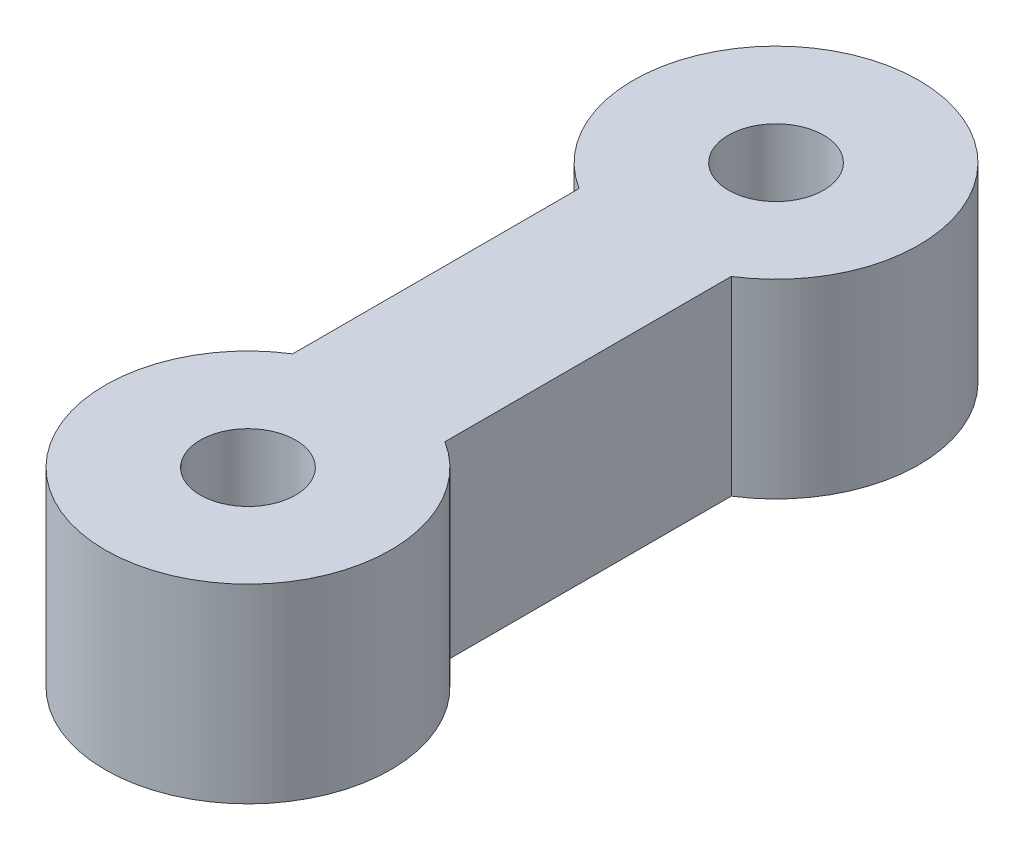
from build123d import *

# Parameters (mm, degrees)
SKETCH_1_R           = 7.505
SKETCH_1_R_2         = 2.505
EXTRUDE_1_DEPTH      = 10
EXTRUDE_3_DEPTH      = 18.25
EXTRUDE_3_DEPTH_BACK = 7
SKETCH_7_W           = 8
SKETCH_7_H           = 10
SKETCH_9_W           = 8
SKETCH_9_H           = 3.5
CUT_EXTRUDE_1_DEPTH  = 18.25
SKETCH_10_R          = 7.505
SKETCH_10_R_2        = 2.505
EXTRUDE_4_DEPTH      = 10
SKETCH_11_R          = 2.505
CUT_EXTRUDE_2_DEPTH  = 10


with BuildPart() as part:
    # 草圖1 → 伸長-薄件1 (new body)
    with BuildSketch(Plane(origin=(0, 0, 0), x_dir=(1, 0, 0), z_dir=(0, 1, 0))):
        Circle(SKETCH_1_R)
        Circle(SKETCH_1_R_2, mode=Mode.SUBTRACT)
    extrude(amount=EXTRUDE_1_DEPTH)

    # 草圖7 → 填料-伸長3 (add, two sides: drawn at the far end of the back side and taken through both)
    with BuildSketch(Plane.XY.offset(13).offset(-EXTRUDE_3_DEPTH_BACK)):
        with Locations((0, 5)):
            Rectangle(SKETCH_7_W, SKETCH_7_H)
    extrude(amount=EXTRUDE_3_DEPTH + EXTRUDE_3_DEPTH_BACK)

    # 草圖9 → 除料-伸長1 (cut)
    with BuildSketch(Plane(origin=(0, 10, 0), x_dir=(1, 0, 0), z_dir=(0, 1, 0))):
        with Locations((0, -29.5)):
            Rectangle(SKETCH_9_W, SKETCH_9_H)
    extrude(amount=-CUT_EXTRUDE_1_DEPTH, mode=Mode.SUBTRACT)

    # 草圖10 → 伸長-薄件4 (add)
    with BuildSketch(Plane(origin=(0, 10, 0), x_dir=(1, 0, 0), z_dir=(0, 1, 0))):
        with Locations((0, -27.75)):
            Circle(SKETCH_10_R)
        with Locations((0, -27.75)):
            Circle(SKETCH_10_R_2, mode=Mode.SUBTRACT)
    extrude(amount=-EXTRUDE_4_DEPTH)

    # 草圖11 → 除料-伸長2 (cut)
    with BuildSketch(Plane(origin=(0, 10, 0), x_dir=(1, 0, 0), z_dir=(0, 1, 0))):
        with Locations(Location((0, -27.75, 0), (0, 0, 270))):
            Circle(SKETCH_11_R)
    extrude(amount=-CUT_EXTRUDE_2_DEPTH, mode=Mode.SUBTRACT)


solid = part.part
